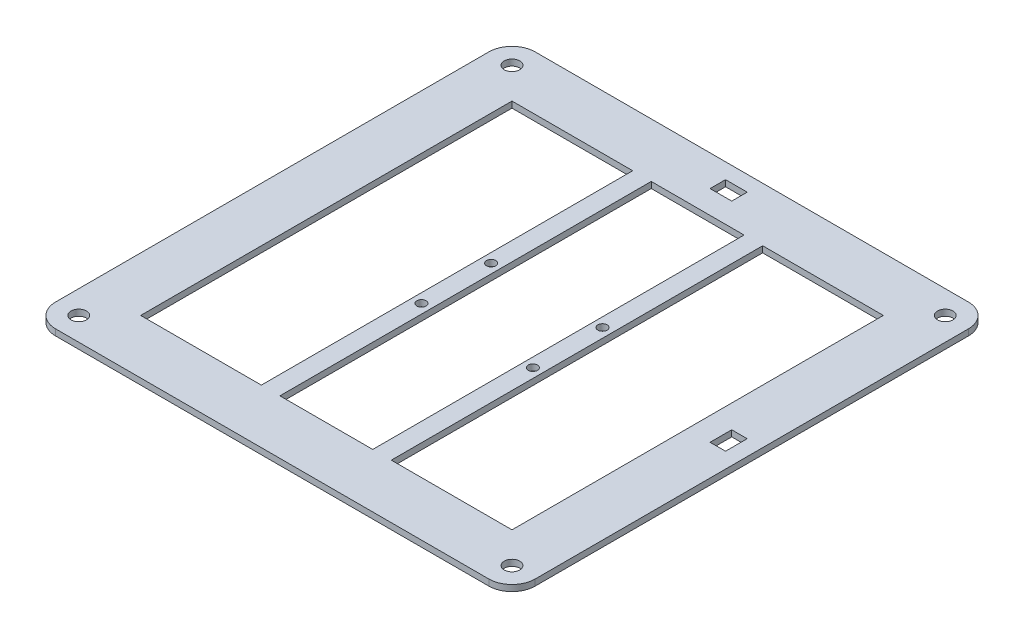
from build123d import *

# Parameters (mm, degrees)
CROQUIS1_W              = 160
CROQUIS1_H              = 160
CROQUIS1_R              = 1.5
CROQUIS1_R_2            = 2.5
CROQUIS1_W_2            = 39
CROQUIS1_H_2            = 120
CROQUIS1_W_3            = 30
CROQUIS1_W_4            = 5
CROQUIS1_H_3            = 7
CROQUIS1_W_5            = 7
CROQUIS1_H_4            = 5
SALIENTE_EXTRUIR1_DEPTH = 2
CROQUIS2_W              = 160
CROQUIS2_H              = 160
CORTAR_EXTRUIR1_DEPTH   = 10


with BuildPart() as part:
    # Croquis1 → Saliente-Extruir1 (new body)
    with BuildSketch(Plane(origin=(0, 0, 0), x_dir=(1, 0, 0), z_dir=(0, 1, 0))):
        with Locations((70, 70)):
            Rectangle(CROQUIS1_W, CROQUIS1_H)
        with Locations(Location((52, 81.25, 0), (0, 0, 270))):
            Circle(CROQUIS1_R, mode=Mode.SUBTRACT)
        with Locations(Location((52, 58.75, 0), (0, 0, 270))):
            Circle(CROQUIS1_R, mode=Mode.SUBTRACT)
        with Locations(Location((0, 140, 0), (0, 0, 270))):
            Circle(CROQUIS1_R_2, mode=Mode.SUBTRACT)
        with Locations(Location((0, 0, 0), (0, 0, 270))):
            Circle(CROQUIS1_R_2, mode=Mode.SUBTRACT)
        with Locations(Location((88, 81.25, 0), (0, 0, 90))):
            Circle(CROQUIS1_R, mode=Mode.SUBTRACT)
        with Locations(Location((88, 58.75, 0), (0, 0, 90))):
            Circle(CROQUIS1_R, mode=Mode.SUBTRACT)
        with Locations(Location((140, 0, 0), (0, 0, 90))):
            Circle(CROQUIS1_R_2, mode=Mode.SUBTRACT)
        with Locations(Location((140, 140, 0), (0, 0, 90))):
            Circle(CROQUIS1_R_2, mode=Mode.SUBTRACT)
        with Locations((29.5, 70)):
            Rectangle(CROQUIS1_W_2, CROQUIS1_H_2, mode=Mode.SUBTRACT)
        with Locations((110.5, 70)):
            Rectangle(CROQUIS1_W_2, CROQUIS1_H_2, mode=Mode.SUBTRACT)
        with Locations((70, 70)):
            Rectangle(CROQUIS1_W_3, CROQUIS1_H_2, mode=Mode.SUBTRACT)
        with Locations((140, 70)):
            Rectangle(CROQUIS1_W_4, CROQUIS1_H_3, mode=Mode.SUBTRACT)
        with Locations((70, 140)):
            Rectangle(CROQUIS1_W_5, CROQUIS1_H_4, mode=Mode.SUBTRACT)
    extrude(amount=SALIENTE_EXTRUIR1_DEPTH)

    # Croquis2 → Cortar-Extruir1 (cut)
    with BuildSketch(Plane(origin=(0, 2, 0), x_dir=(1, 0, 0), z_dir=(0, 1, 0))):
        with Locations((70, 70)):
            Rectangle(CROQUIS2_W, CROQUIS2_H)
        with BuildLine():
            Line((0, 147.5), (140, 147.5))
            ThreePointArc((140, 147.5), (145.303300859, 145.303300859), (147.5, 140))
            Line((147.5, 140), (147.5, 0))
            ThreePointArc((147.5, 0), (145.303300859, -5.303300859), (140, -7.5))
            Line((140, -7.5), (0, -7.5))
            ThreePointArc((0, -7.5), (-5.303300859, -5.303300859), (-7.5, 0))
            Line((-7.5, 0), (-7.5, 140))
            ThreePointArc((-7.5, 140), (-5.303300859, 145.303300859), (0, 147.5))
        make_face(mode=Mode.SUBTRACT)
    extrude(amount=-CORTAR_EXTRUIR1_DEPTH, mode=Mode.SUBTRACT)


solid = part.part
